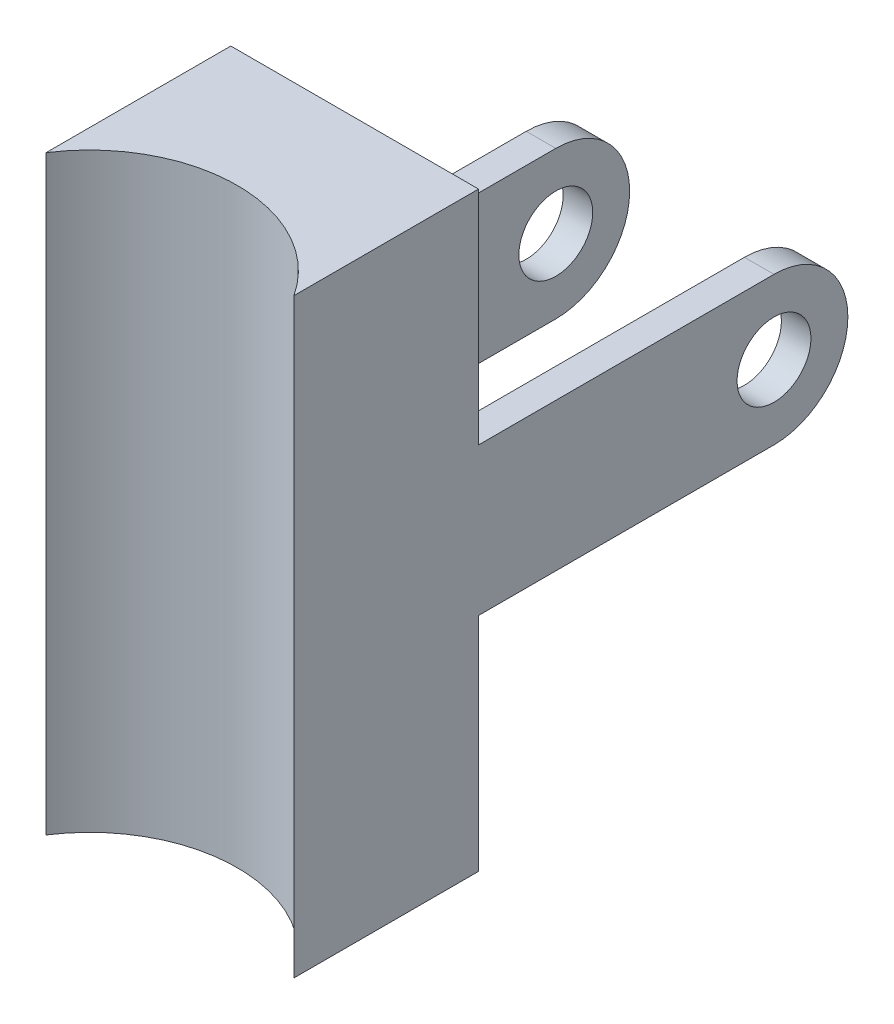
from build123d import *

# Parameters (mm, degrees)
BOSS_EXTRUDE2_DEPTH = 101.6
BOSS_EXTRUDE3_DEPTH = 5.08
SKETCH4_R           = 6.35
CUT_EXTRUDE1_DEPTH  = 156.040615371


with BuildPart() as part:
    # Sketch1 → Boss-Extrude2 (new body)
    with BuildSketch(Plane(origin=(0, 0, 0), x_dir=(1, 0, 0), z_dir=(0, 1, 0))):
        with BuildLine():
            Line((-21.298547486, 13.839504146), (-21.298547486, 45.589504146))
            Line((-21.298547486, 45.589504146), (21.298547486, 45.589504146))
            Line((21.298547486, 45.589504146), (21.298547486, 13.839504146))
            ThreePointArc((21.298547486, 13.839504146), (0, 25.4), (-21.298547486, 13.839504146))
        make_face()
    extrude(amount=BOSS_EXTRUDE2_DEPTH)

    # Sketch3 → Boss-Extrude3 (add)
    with BuildSketch(Plane.ZY.offset(21.298547486)):
        with BuildLine():
            Line((-45.589504146, 63.5), (-96.389504146, 63.5))
            ThreePointArc((-96.389504146, 63.5), (-109.089504146, 50.8), (-96.389504146, 38.1))
            Line((-96.389504146, 38.1), (-45.589504146, 38.1))
            Line((-45.589504146, 38.1), (-45.589504146, 63.5))
        make_face()
    boss_extrude3 = extrude(amount=-BOSS_EXTRUDE3_DEPTH)

    # Sketch4 → Cut-Extrude1 (cut, through all)
    with BuildSketch(Plane.ZY.offset(21.298547486)):
        with Locations((-96.389504146, 50.8)):
            Circle(SKETCH4_R)
    cut_extrude1 = extrude(amount=-CUT_EXTRUDE1_DEPTH, mode=Mode.SUBTRACT)

    # Mirror1: Boss-Extrude3, Cut-Extrude1 across plane
    add(boss_extrude3.mirror(Plane(origin=(0, 0, 0), x_dir=(0, 0, 1), z_dir=(1, 0, 0))))
    add(cut_extrude1.mirror(Plane(origin=(0, 0, 0), x_dir=(0, 0, 1), z_dir=(1, 0, 0))), mode=Mode.SUBTRACT)


solid = part.part
